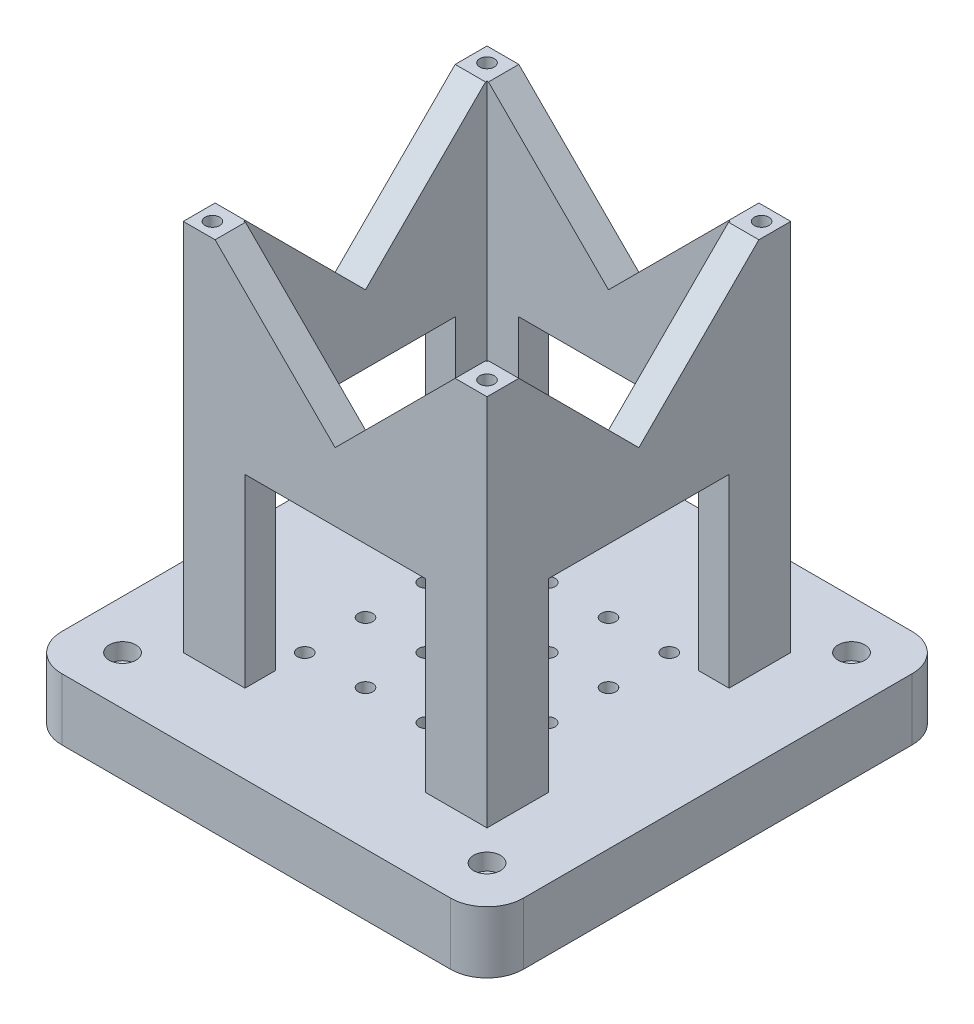
from build123d import *

# Parameters (mm, degrees)
EXTRUDE2_DEPTH               = 25.4
SKETCH3_W                    = 125
SKETCH3_H                    = 125
EXTRUDE3_DEPTH               = 153.67
SKETCH4_W                    = 100
SKETCH4_H                    = 100
CUT_EXTRUDE1_DEPTH           = 153.67
SKETCH5_W                    = 74.2
SKETCH5_H                    = 76.2
CUT_EXTRUDE2_DEPTH           = 305.913618751
SKETCH6_W                    = 74.2
SKETCH6_H                    = 76.2
CUT_EXTRUDE3_DEPTH           = 305.913618751
HOLE_WIZARD_M6_3_D           = 5
HOLE_WIZARD_M6_3_DEPTH       = 15
HOLE_WIZARD_M6_3_CBORE_D     = 6
HOLE_WIZARD_M6_3_CBORE_DEPTH = 12
HOLE_WIZARD_M6_3_TIP         = 1.502151548
HOLE_WIZARD_1_D              = 6.6
HOLE_WIZARD_1_CBORE_D        = 11
HOLE_WIZARD_1_CBORE_DEPTH    = 6.8
HOLE_WIZARD_M6_2_D           = 6
LPATTERN2_COUNT              = 4
LPATTERN2_PITCH              = 25
LPATTERN2_COUNT_DIR2         = 4
LPATTERN2_PITCH_DIR2         = 25


with BuildPart() as part:
    # Sketch2 → Extrude2 (new body)
    with BuildSketch(Plane(origin=(0, 0, 0), x_dir=(1, 0, 0), z_dir=(0, 1, 0))):
        with BuildLine():
            Line((15, 0), (175, 0))
            ThreePointArc((175, 0), (185.606601718, 4.393398282), (190, 15))
            Line((190, 15), (190, 175))
            ThreePointArc((190, 175), (185.606601718, 185.606601718), (175, 190))
            Line((175, 190), (15, 190))
            ThreePointArc((15, 190), (4.393398282, 185.606601718), (0, 175))
            Line((0, 175), (0, 15))
            ThreePointArc((0, 15), (4.393398282, 4.393398282), (15, 0))
        make_face()
    extrude(amount=EXTRUDE2_DEPTH)

    # Sketch3 → Extrude3 (add)
    with BuildSketch(Plane(origin=(0, 25.4, 0), x_dir=(-1, 0, 0), z_dir=(0, 1, 0))):
        with Locations((-95, -95)):
            Rectangle(SKETCH3_W, SKETCH3_H)
    extrude(amount=EXTRUDE3_DEPTH)

    # Sketch4 → Cut-Extrude1 (cut)
    with BuildSketch(Plane(origin=(0, 179.07, 0), x_dir=(-1, 0, 0), z_dir=(0, 1, 0))):
        with Locations((-95, -95)):
            Rectangle(SKETCH4_W, SKETCH4_H)
    extrude(amount=-CUT_EXTRUDE1_DEPTH, mode=Mode.SUBTRACT)

    # Sketch5 → Cut-Extrude2 (cut, through all)
    with BuildSketch(Plane.XY.offset(-32.5)):
        Polygon((45.6085824, 179.07), (144.3914176, 179.07), (95, 129.6785824), align=None)
        with Locations((95, 63.5)):
            Rectangle(SKETCH5_W, SKETCH5_H)
    extrude(amount=-CUT_EXTRUDE2_DEPTH, mode=Mode.SUBTRACT)

    # Sketch6 → Cut-Extrude3 (cut, through all)
    with BuildSketch(Plane(origin=(157.5, 0, 0), x_dir=(0, 0, -1), z_dir=(1, 0, 0))):
        Polygon((45.6085824, 179.07), (144.3914176, 179.07), (95, 129.6785824), align=None)
        with Locations((95, 63.5)):
            Rectangle(SKETCH6_W, SKETCH6_H)
    extrude(amount=-CUT_EXTRUDE3_DEPTH, mode=Mode.SUBTRACT)

    # M6 螺纹孔3
    with Locations(Plane(origin=(0, 179.07, 0), x_dir=(-1, 0, 0), z_dir=(0, 1, 0))):
        with Locations((-151.5, -151.5), (-151.5, -38.5), (-38.5, -38.5), (-38.5, -151.5)):
            CounterBoreHole(HOLE_WIZARD_M6_3_D / 2, HOLE_WIZARD_M6_3_CBORE_D / 2, HOLE_WIZARD_M6_3_CBORE_DEPTH, depth=HOLE_WIZARD_M6_3_DEPTH)
            with Locations((0, 0, -(HOLE_WIZARD_M6_3_DEPTH + HOLE_WIZARD_M6_3_TIP / 2))):  # 118° drill point
                Cone(0, HOLE_WIZARD_M6_3_D / 2, HOLE_WIZARD_M6_3_TIP, mode=Mode.SUBTRACT)

    # 打孔尺寸(%根据)内六角圆柱头螺钉的类型1 (through all)
    with Locations(Plane(origin=(0, 25.4, 0), x_dir=(-1, 0, 0), z_dir=(0, 1, 0))):
        with Locations((-170, -20), (-170, -170), (-20, -170), (-20, -20)):
            CounterBoreHole(HOLE_WIZARD_1_D / 2, HOLE_WIZARD_1_CBORE_D / 2, HOLE_WIZARD_1_CBORE_DEPTH)

    # M6 螺纹孔2 (through all)
    with Locations(Plane(origin=(0, 25.4, 0), x_dir=(-1, 0, 0), z_dir=(0, 1, 0))):
        with Locations((-57.5, -132.5)):
            hole_wizard_m6_2 = Hole(HOLE_WIZARD_M6_2_D / 2)

    # LPattern2: Hole Wizard M6 _2 4 × 4
    with Locations(*[(i * LPATTERN2_PITCH, 0, j * LPATTERN2_PITCH_DIR2) for i in range(LPATTERN2_COUNT) for j in range(LPATTERN2_COUNT_DIR2) if (i, j) != (0, 0)]):
        add(hole_wizard_m6_2, mode=Mode.SUBTRACT)


solid = part.part
